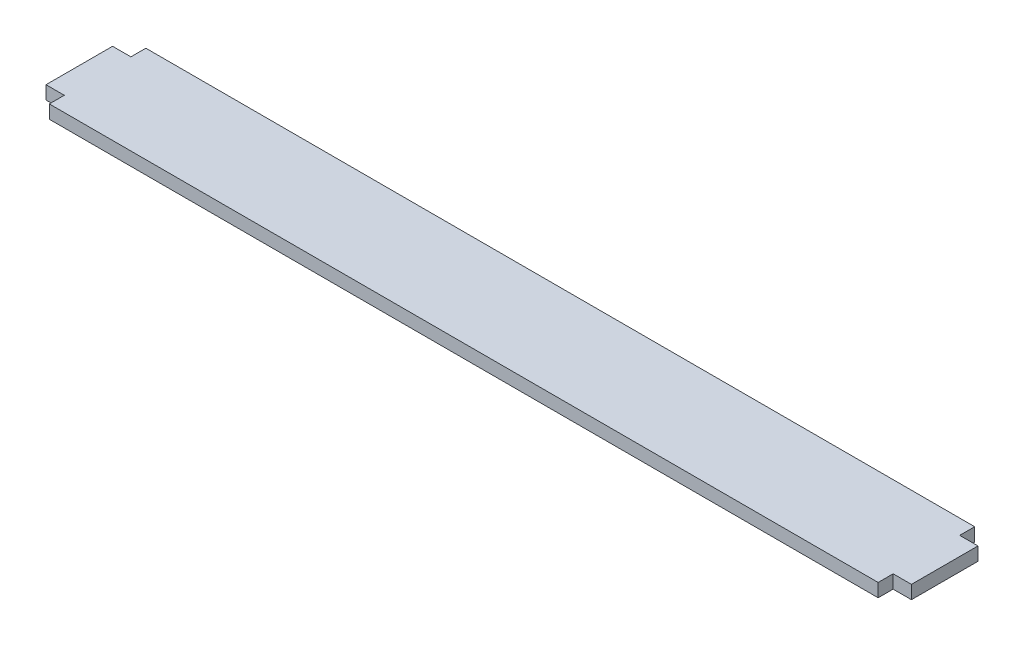
from build123d import *

# Parameters (mm, degrees)
SKETCH_1_W      = 249
SKETCH_1_H      = 28.996988848
EXTRUDE_1_DEPTH = 4
SKETCH_2_W      = 20
SKETCH_2_H      = 4
EXTRUDE_2_DEPTH = 5.5


with BuildPart() as part:
    # Эскиз1 → Бобышка-Вытянуть1 (new body)
    with BuildSketch(Plane(origin=(0, 0, 0), x_dir=(1, 0, 0), z_dir=(0, 1, 0))):
        Rectangle(SKETCH_1_W, SKETCH_1_H)
    extrude(amount=EXTRUDE_1_DEPTH)

    # Эскиз2 → Бобышка-Вытянуть2 (add)
    with BuildSketch(Plane(origin=(124.5, 0, 0), x_dir=(0, 0, -1), z_dir=(1, 0, 0))):
        with Locations((0, 2)):
            Rectangle(SKETCH_2_W, SKETCH_2_H)
    extrude_2 = extrude(amount=EXTRUDE_2_DEPTH)

    # Mirror1: Бобышка-Вытянуть2 across plane
    add(extrude_2.mirror(Plane(origin=(0, 0, 0), x_dir=(0, 0, 1), z_dir=(1, 0, 0))))


solid = part.part
